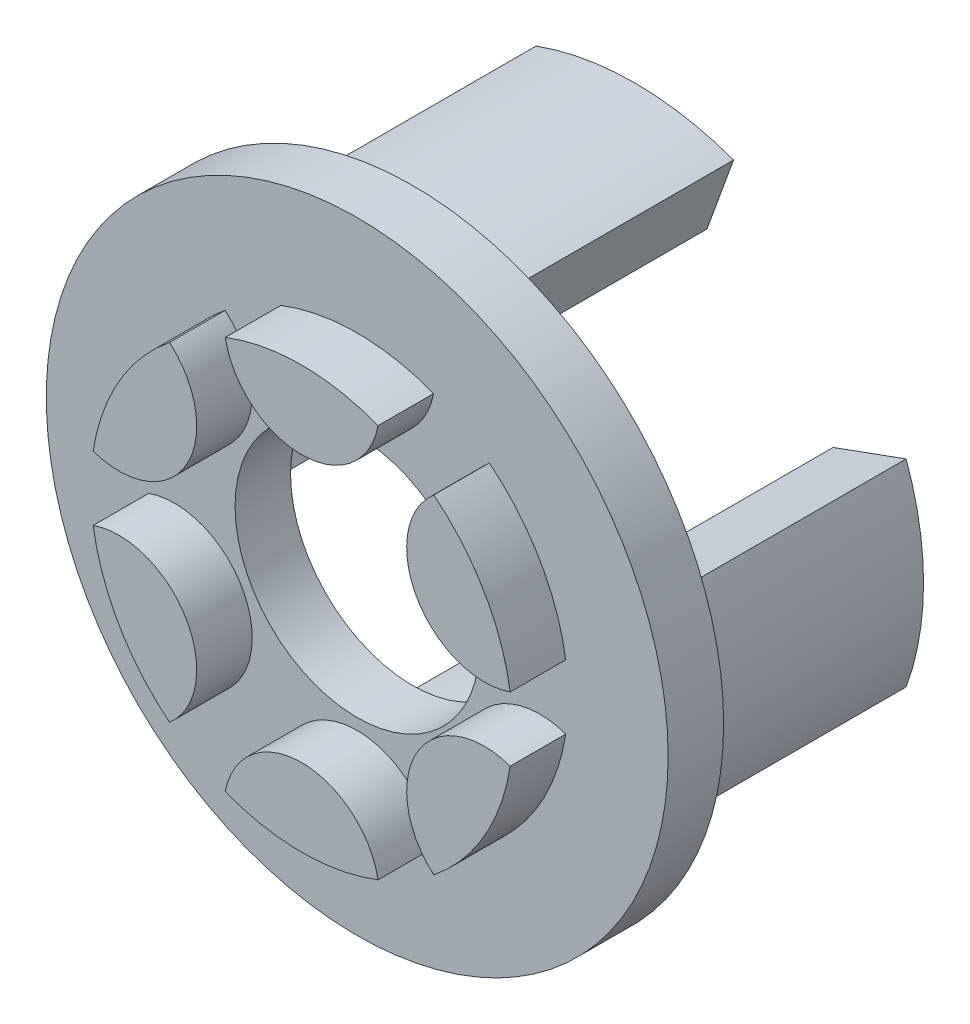
from build123d import *

# Parameters (mm, degrees)
SKETCH_1_R          = 28
EXTRUDE_1_DEPTH     = 5
EXTRUDE_2_DEPTH     = 20
SKETCH_3_R          = 11
CUT_EXTRUDE_1_DEPTH = 5
EXTRUDE_START       = 5
EXTRUDE_4_DEPTH     = 5


with BuildPart() as part:
    # 草图1 → 凸台-拉伸1 (new body)
    with BuildSketch(Plane.XY):
        Circle(SKETCH_1_R)
    extrude(amount=EXTRUDE_1_DEPTH)

    # 草图2 → 凸台-拉伸2 (add)
    with BuildSketch(Plane(origin=(0, 0, 0), x_dir=(-1, 0, 0), z_dir=(0, 0, -1))):
        with BuildLine():
            Line((-6.498382723, 17.854159795), (-8.892523726, 24.43200814))
            ThreePointArc((-8.892523726, 24.43200814), (0, 26), (8.892523726, 24.43200814))
            Line((8.892523726, 24.43200814), (6.498382723, 17.854159795))
            ThreePointArc((6.498382723, 17.854159795), (0, 19), (-6.498382723, 17.854159795))
        make_face()
        with BuildLine():
            Line((17.854159795, 6.498382723), (24.43200814, 8.892523726))
            ThreePointArc((24.43200814, 8.892523726), (26, 0), (24.43200814, -8.892523726))
            Line((24.43200814, -8.892523726), (17.854159795, -6.498382723))
            ThreePointArc((17.854159795, -6.498382723), (19, 0), (17.854159795, 6.498382723))
        make_face()
        with BuildLine():
            Line((6.498382723, -17.854159795), (8.892523726, -24.43200814))
            ThreePointArc((8.892523726, -24.43200814), (0, -26), (-8.892523726, -24.43200814))
            Line((-8.892523726, -24.43200814), (-6.498382723, -17.854159795))
            ThreePointArc((-6.498382723, -17.854159795), (0, -19), (6.498382723, -17.854159795))
        make_face()
        with BuildLine():
            Line((-17.854159795, -6.498382723), (-24.43200814, -8.892523726))
            ThreePointArc((-24.43200814, -8.892523726), (-26, 0), (-24.43200814, 8.892523726))
            Line((-24.43200814, 8.892523726), (-17.854159795, 6.498382723))
            ThreePointArc((-17.854159795, 6.498382723), (-19, 0), (-17.854159795, -6.498382723))
        make_face()
    extrude(amount=EXTRUDE_2_DEPTH)

    # 草图3 → 切除-拉伸1 (cut)
    with BuildSketch(Plane(origin=(0, 0, 0), x_dir=(-1, 0, 0), z_dir=(0, 0, -1))):
        Circle(SKETCH_3_R)
    extrude(amount=-CUT_EXTRUDE_1_DEPTH, mode=Mode.SUBTRACT)

    # 草图4 → 凸台-拉伸4 (add)
    with BuildSketch(Plane.XY.offset(5).offset(EXTRUDE_START)):
        with BuildLine():
            ThreePointArc((-6.880207673, 17.710526316), (0, 12), (6.880207673, 17.710526316))
            ThreePointArc((6.880207673, 17.710526316), (0, 19), (-6.880207673, 17.710526316))
        make_face()
        with BuildLine():
            ThreePointArc((11.897661868, 14.813697786), (10.392304845, 6), (18.77786954, 2.89682853))
            ThreePointArc((18.77786954, 2.89682853), (16.454482672, 9.5), (11.897661868, 14.813697786))
        make_face()
        with BuildLine():
            ThreePointArc((18.77786954, -2.89682853), (10.392304845, -6), (11.897661868, -14.813697786))
            ThreePointArc((11.897661868, -14.813697786), (16.454482672, -9.5), (18.77786954, -2.89682853))
        make_face()
        with BuildLine():
            ThreePointArc((6.880207673, -17.710526316), (0, -12), (-6.880207673, -17.710526316))
            ThreePointArc((-6.880207673, -17.710526316), (0, -19), (6.880207673, -17.710526316))
        make_face()
        with BuildLine():
            ThreePointArc((-11.897661868, -14.813697786), (-10.392304845, -6), (-18.77786954, -2.89682853))
            ThreePointArc((-18.77786954, -2.89682853), (-16.454482672, -9.5), (-11.897661868, -14.813697786))
        make_face()
        with BuildLine():
            ThreePointArc((-18.77786954, 2.89682853), (-10.392304845, 6), (-11.897661868, 14.813697786))
            ThreePointArc((-11.897661868, 14.813697786), (-16.454482672, 9.5), (-18.77786954, 2.89682853))
        make_face()
    extrude(amount=-EXTRUDE_4_DEPTH)


solid = part.part
